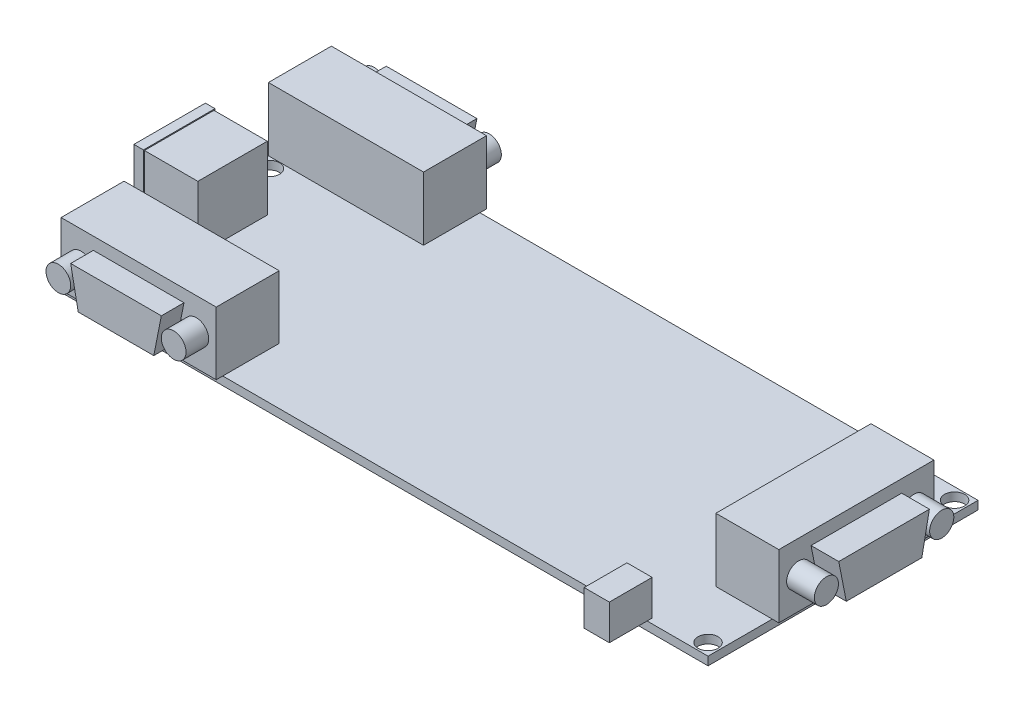
from build123d import *

# Parameters (mm, degrees)
SKETCH1_W           = 129.7
SKETCH1_H           = 53.6
BOARDBASE_DEPTH     = 1.67
SKETCH3_W           = 12.5
SKETCH3_H           = 30.8
BOSS_EXTRUDE2_DEPTH = 12.6
SKETCH4_R           = 2.4
BOSS_EXTRUDE3_DEPTH = 5.5
SKETCH6_W           = 30.8
SKETCH6_H           = 12.5
BOSS_EXTRUDE5_DEPTH = 12.5
SKETCH7_R           = 2.45
BOSS_EXTRUDE6_DEPTH = 4.5
SKETCH5_W           = 30.8
SKETCH5_H           = 12.5
BOSS_EXTRUDE4_DEPTH = 12.6
SKETCH9_R           = 2.4
BOSS_EXTRUDE7_DEPTH = 4.5
SKETCH10_W          = 10.6
SKETCH10_H          = 13.8
BOSS_EXTRUDE8_DEPTH = 12.7
SKETCH12_W          = 14.2
SKETCH12_H          = 13.1
BOSS_EXTRUDE9_DEPTH = 1.9
SKETCH13_W          = 5.2
SKETCH13_H          = 46.3
MOLEXHEADER_DEPTH   = 2.7
SKETCH14_R          = 2
MOUNTHOLES_DEPTH    = 80.767740973
SKETCH15_W          = 5
SKETCH15_H          = 8.5
STIMHEADER_DEPTH    = 7


with BuildPart() as part:
    # Sketch1 → BoardBase (new body)
    with BuildSketch(Plane(origin=(0, 0, 0), x_dir=(1, 0, 0), z_dir=(0, 1, 0))):
        Rectangle(SKETCH1_W, SKETCH1_H)
    extrude(amount=BOARDBASE_DEPTH)

    # Sketch3 → Boss-Extrude2 (add)
    with BuildSketch(Plane(origin=(0, 1.67, 0), x_dir=(1, 0, 0), z_dir=(0, 1, 0))):
        with Locations((59.9, 1.35)):
            Rectangle(SKETCH3_W, SKETCH3_H)
    extrude(amount=BOSS_EXTRUDE2_DEPTH)

    # Sketch4 → Boss-Extrude3 (add)
    with BuildSketch(Plane(origin=(66.15, 0, 0), x_dir=(0, 0, -1), z_dir=(1, 0, 0))):
        with Locations(Location((-10.1, 7.97, 0), (0, 0, 180))):
            Circle(SKETCH4_R)
        with Locations(Location((12.8, 7.97, 0), (0, 0, 180))):
            Circle(SKETCH4_R)
        Polygon((-7.65, 11.77), (10.35, 11.77), (8.85, 4.17), (-6.15, 4.17), align=None)
    extrude(amount=BOSS_EXTRUDE3_DEPTH)

    # Sketch6 → Boss-Extrude5 (add)
    with BuildSketch(Plane(origin=(0, 1.67, 0), x_dir=(1, 0, 0), z_dir=(0, 1, 0))):
        with Locations((-46.9, -21.85)):
            Rectangle(SKETCH6_W, SKETCH6_H)
    extrude(amount=BOSS_EXTRUDE5_DEPTH)

    # Sketch7 → Boss-Extrude6 (add)
    with BuildSketch(Plane.XY.offset(28.1)):
        with Locations(Location((-58.35, 7.92, 0), (0, 0, 180))):
            Circle(SKETCH7_R)
        with Locations(Location((-35.45, 7.92, 0), (0, 0, 180))):
            Circle(SKETCH7_R)
        Polygon((-55.9, 11.72), (-37.9, 11.72), (-39.4, 4.12), (-54.4, 4.12), align=None)
    extrude(amount=BOSS_EXTRUDE6_DEPTH)

    # Sketch5 → Boss-Extrude4 (add)
    with BuildSketch(Plane(origin=(0, 1.67, 0), x_dir=(1, 0, 0), z_dir=(0, 1, 0))):
        with Locations((-49.44, 21.85)):
            Rectangle(SKETCH5_W, SKETCH5_H)
    extrude(amount=BOSS_EXTRUDE4_DEPTH)

    # Sketch9 → Boss-Extrude7 (add)
    with BuildSketch(Plane(origin=(0, 0, -28.1), x_dir=(-1, 0, 0), z_dir=(0, 0, -1))):
        with Locations(Location((37.99, 7.97, 0), (0, 0, 180))):
            Circle(SKETCH9_R)
        with Locations(Location((60.89, 7.97, 0), (0, 0, 180))):
            Circle(SKETCH9_R)
        Polygon((40.44, 11.77), (58.44, 11.77), (56.94, 4.17), (41.94, 4.17), align=None)
    extrude(amount=BOSS_EXTRUDE7_DEPTH)

    # Sketch10 → Boss-Extrude8 (add)
    with BuildSketch(Plane(origin=(0, 1.67, 0), x_dir=(1, 0, 0), z_dir=(0, 1, 0))):
        with Locations((-60.05, -1.6)):
            Rectangle(SKETCH10_W, SKETCH10_H)
    extrude(amount=BOSS_EXTRUDE8_DEPTH)

    # Sketch12 → Boss-Extrude9 (add)
    with BuildSketch(Plane.ZY.offset(65.35)):
        with Locations((1.6, 8.02)):
            Rectangle(SKETCH12_W, SKETCH12_H)
    extrude(amount=BOSS_EXTRUDE9_DEPTH)

    # Sketch13 → MolexHeader (add)
    with BuildSketch(Plane.XZ):
        with Locations((45.75, -2.65)):
            Rectangle(SKETCH13_W, SKETCH13_H)
    extrude(amount=MOLEXHEADER_DEPTH)

    # Sketch14 → MountHoles (cut, through all)
    with BuildSketch(Plane(origin=(0, 1.67, 0), x_dir=(1, 0, 0), z_dir=(0, 1, 0))):
        with Locations(Location((62.5, 24.5, 0), (0, 0, 270))):
            Circle(SKETCH14_R)
        with Locations(Location((62.5, -24.45, 0), (0, 0, 270))):
            Circle(SKETCH14_R)
        with Locations(Location((-62.55, -12.9, 0), (0, 0, 270))):
            Circle(SKETCH14_R)
        with Locations(Location((-62.55, 13.5, 0), (0, 0, 270))):
            Circle(SKETCH14_R)
    extrude(amount=-MOUNTHOLES_DEPTH, mode=Mode.SUBTRACT)

    # Sketch15 → StimHeader (add)
    with BuildSketch(Plane(origin=(0, 1.67, 0), x_dir=(1, 0, 0), z_dir=(0, 1, 0))):
        with Locations((50.25, -30.05)):
            Rectangle(SKETCH15_W, SKETCH15_H)
    extrude(amount=STIMHEADER_DEPTH)


solid = part.part
